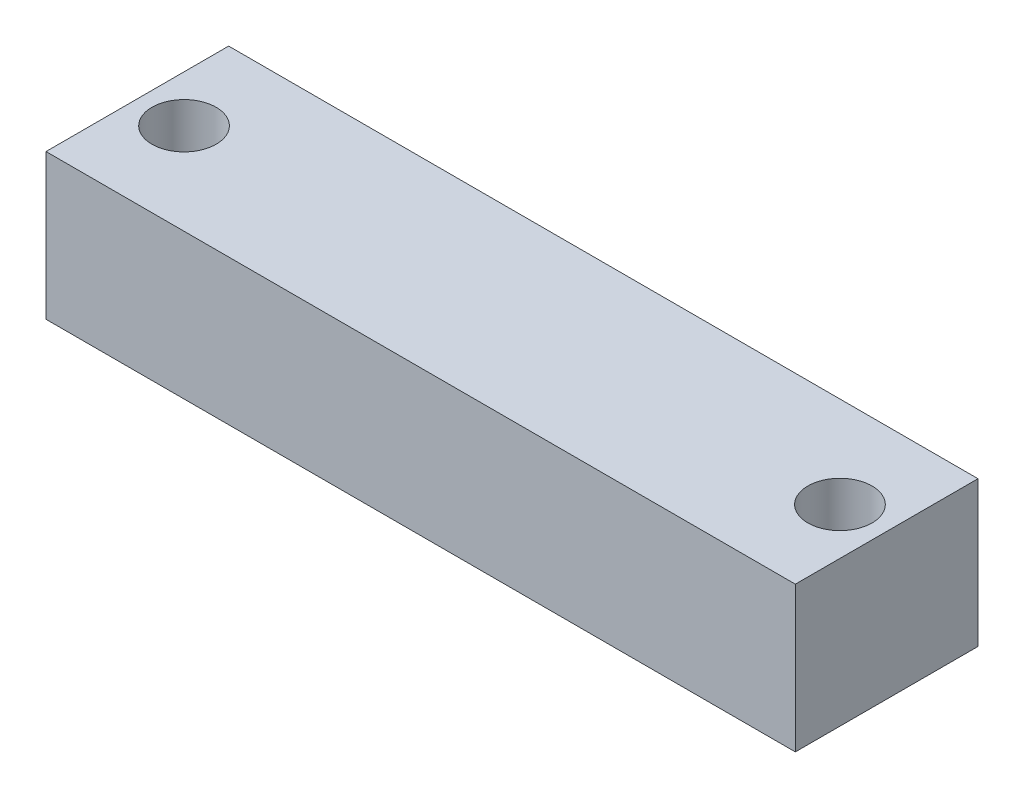
from build123d import *

# Parameters (mm, degrees)
SKETCH1_W               = 90.25
SKETCH1_H               = 22
BOSS_EXTRUDE1_DEPTH     = 17.5
CUT_EXTRUDE1_DEPTH      = 50.633815338
CUT_EXTRUDE1_DEPTH_BACK = 50.633815338
SKETCH2_R               = 1.5
SKETCH3_R               = 3.865
SKETCH3_R_2             = 1.5
CUT_EXTRUDE2_DEPTH      = 10


with BuildPart() as part:
    # Sketch1 → Boss-Extrude1 (new body)
    with BuildSketch(Plane(origin=(0, 0, 0), x_dir=(1, 0, 0), z_dir=(0, 1, 0))):
        Rectangle(SKETCH1_W, SKETCH1_H)
    extrude(amount=BOSS_EXTRUDE1_DEPTH)

    # Sketch2 → Cut-Extrude1 (cut, two sides: drawn at the far end of the back side and taken through both)
    with BuildSketch(Plane(origin=(0, 17.5, 0), x_dir=(1, 0, 0), z_dir=(0, 1, 0)).offset(-CUT_EXTRUDE1_DEPTH_BACK)):
        with Locations(Location((-39.5, 0, 0), (0, 0, 270))):
            Circle(SKETCH2_R)
        with Locations(Location((39.5, 0, 0), (0, 0, 270))):
            Circle(SKETCH2_R)
    extrude(amount=CUT_EXTRUDE1_DEPTH + CUT_EXTRUDE1_DEPTH_BACK, mode=Mode.SUBTRACT)

    # Sketch3 → Cut-Extrude2 (cut)
    # profile 1 of 2: a face of its own
    with BuildSketch(Plane(origin=(0, 17.5, 0), x_dir=(1, 0, 0), z_dir=(0, 1, 0))):
        with Locations(Location((-39.5, 0, 0), (0, 0, 270))):
            Circle(SKETCH3_R)
        with Locations(Location((-39.5, 0, 0), (0, 0, 270))):
            Circle(SKETCH3_R_2, mode=Mode.SUBTRACT)
    # profile 2 of 2: a face of its own
    with BuildSketch(Plane(origin=(0, 17.5, 0), x_dir=(1, 0, 0), z_dir=(0, 1, 0))):
        with Locations(Location((39.5, 0, 0), (0, 0, 270))):
            Circle(SKETCH3_R)
        with Locations(Location((39.5, 0, 0), (0, 0, 270))):
            Circle(SKETCH3_R_2, mode=Mode.SUBTRACT)
    extrude(amount=-CUT_EXTRUDE2_DEPTH, mode=Mode.SUBTRACT)


solid = part.part
